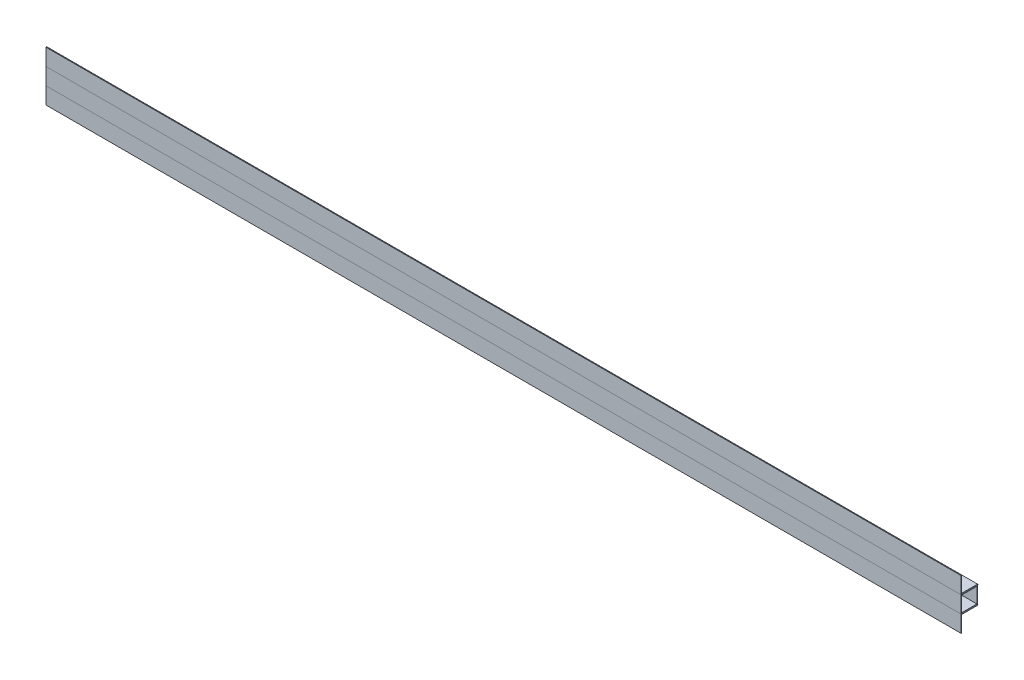
from build123d import *

# Parameters (mm, degrees)
SKETCH1_W                                      = 25.4
SKETCH1_H                                      = 25.4
SKETCH1_W_2                                    = 23.4
SKETCH1_H_2                                    = 23.4
SQURE_TUBE_1X1SQUARE_TUBE_1_DEPTH              = 1392.049939
ANGLEIRON_ANGLE_IRON_ONE_BY_ONE_INCH_2ND_DEPTH = 1392.049939
ANGLEIRON_ANGLE_IRON_ONE_BY_ONE_INCH_2_DEPTH   = 1392.049939


with BuildPart() as part:
    # Sketch1 → Squre tube 1X1SQUARE TUBE(1) (new body)
    with BuildSketch(Plane(origin=(0, 0, 0), x_dir=(0, 0, -1), z_dir=(1, 0, 0))):
        Rectangle(SKETCH1_W, SKETCH1_H)
        Rectangle(SKETCH1_W_2, SKETCH1_H_2, mode=Mode.SUBTRACT)
    extrude(amount=SQURE_TUBE_1X1SQUARE_TUBE_1_DEPTH)


with BuildPart() as body_2:
    # Sketch13 → Angleiron ANGLE IRON ONE BY ONE INCH 2ND (new body)
    with BuildSketch(Plane(origin=(0, 12.7, 12.7), x_dir=(0, 0, -1), z_dir=(1, 0, 0))):
        Polygon((1.25, 25.4), (1.25, 1.25), (25.4, 1.25), (26.025, 0.625), (25.4, 0), (0, 0), (0, 25.4), (0.625, 26.025), align=None)
    extrude(amount=ANGLEIRON_ANGLE_IRON_ONE_BY_ONE_INCH_2ND_DEPTH)


with BuildPart() as body_3:
    # Sketch14 → Angleiron ANGLE IRON ONE BY ONE INCH 2 (new body)
    with BuildSketch(Plane(origin=(0, -12.7, 12.7), x_dir=(0, 0, -1), z_dir=(-1, 0, 0))):
        Polygon((1.25, 25.4), (1.25, 1.25), (25.4, 1.25), (26.025, 0.625), (25.4, 0), (0, 0), (0, 25.4), (0.625, 26.025), align=None)
    extrude(amount=-ANGLEIRON_ANGLE_IRON_ONE_BY_ONE_INCH_2_DEPTH)


solid = Compound([part.part, body_2.part, body_3.part])
